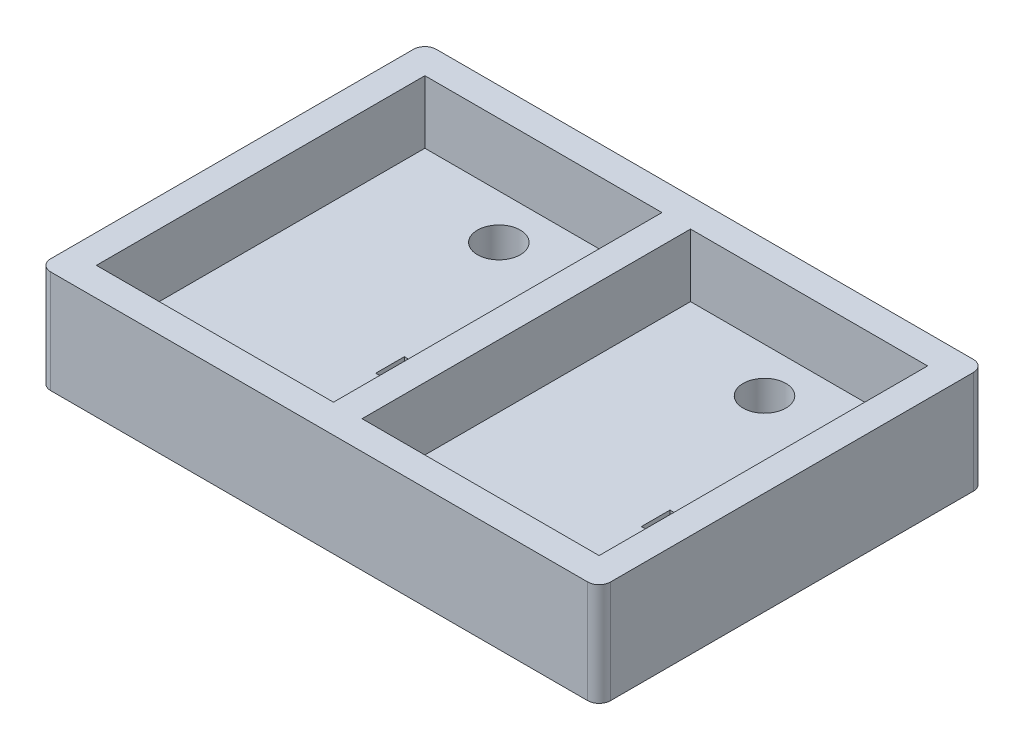
from build123d import *

# Parameters (mm, degrees)
SKETCH1_W           = 65.405
SKETCH1_H           = 85.725
BOSS_EXTRUDE1_DEPTH = 22.86
SKETCH2_W           = 52.705
SKETCH2_H           = 73.025
CUT_EXTRUDE1_DEPTH  = 13.97
SKETCH6_W           = 6.35
SKETCH6_H           = 6.35
CUT_EXTRUDE3_DEPTH  = 5.08
SKETCH7_W           = 2.54
SKETCH7_H           = 2.54
CUT_EXTRUDE4_DEPTH  = 110.496539443
SKETCH5_R           = 4.7625
CUT_EXTRUDE5_DEPTH  = 109.727873841
LPATTERN3_COUNT     = 2
LPATTERN3_PITCH     = 59.055
FILLET1_R           = 2.54


with BuildPart() as part:
    # Sketch1 → Boss-Extrude1 (new body)
    with BuildSketch(Plane(origin=(0, 0, 0), x_dir=(1, 0, 0), z_dir=(0, 1, 0))):
        with Locations((32.7025, 42.8625)):
            Rectangle(SKETCH1_W, SKETCH1_H)
    boss_extrude1 = extrude(amount=BOSS_EXTRUDE1_DEPTH)

    # Sketch2 → Cut-Extrude1 (cut)
    with BuildSketch(Plane(origin=(0, 22.86, 0), x_dir=(1, 0, 0), z_dir=(0, 1, 0))):
        with Locations((32.7025, 42.8625)):
            Rectangle(SKETCH2_W, SKETCH2_H)
    cut_extrude1 = extrude(amount=-CUT_EXTRUDE1_DEPTH, mode=Mode.SUBTRACT)

    # Sketch6 → Cut-Extrude3 (cut)
    with BuildSketch(Plane(origin=(0, 8.89, 0), x_dir=(1, 0, 0), z_dir=(0, 1, 0))):
        with Locations((47.371, 33.782)):
            Rectangle(SKETCH6_W, SKETCH6_H)
        with Locations((47.371, 13.716)):
            Rectangle(SKETCH6_W, SKETCH6_H)
    cut_extrude3 = extrude(amount=-CUT_EXTRUDE3_DEPTH, mode=Mode.SUBTRACT)

    # Sketch7 → Cut-Extrude4 (cut, through all)
    with BuildSketch(Plane(origin=(0, 3.81, 0), x_dir=(1, 0, 0), z_dir=(0, 1, 0))):
        with Locations((47.371, 33.782)):
            Rectangle(SKETCH7_W, SKETCH7_H)
        with Locations((47.371, 13.716)):
            Rectangle(SKETCH7_W, SKETCH7_H)
    cut_extrude4 = extrude(amount=-CUT_EXTRUDE4_DEPTH, mode=Mode.SUBTRACT)

    # Sketch5 → Cut-Extrude5 (cut, through all)
    with BuildSketch(Plane(origin=(0, 8.89, 0), x_dir=(1, 0, 0), z_dir=(0, 1, 0))):
        with Locations(Location((32.7025, 69.469, 0), (0, 0, 270))):
            Circle(SKETCH5_R)
    cut_extrude5 = extrude(amount=-CUT_EXTRUDE5_DEPTH, mode=Mode.SUBTRACT)

    # LPattern3: Boss-Extrude1, Cut-Extrude1, Cut-Extrude3, Cut-Extrude4, Cut-Extrude5 ×2
    with Locations(*[(i * LPATTERN3_PITCH, 0, 0) for i in range(1, LPATTERN3_COUNT)]):
        add(boss_extrude1)
        add(cut_extrude1, mode=Mode.SUBTRACT)
        add(cut_extrude3, mode=Mode.SUBTRACT)
        add(cut_extrude4, mode=Mode.SUBTRACT)
        add(cut_extrude5, mode=Mode.SUBTRACT)

    # Fillet1
    fillet1_edges = [part.edges().sort_by_distance(p)[0] for p in [
        (0, 11.43, -85.725),
        (0, 11.43, 0),
        (124.46, 11.43, -85.725),
        (124.46, 11.43, 0),
    ]]
    fillet(fillet1_edges, radius=FILLET1_R)


solid = part.part
